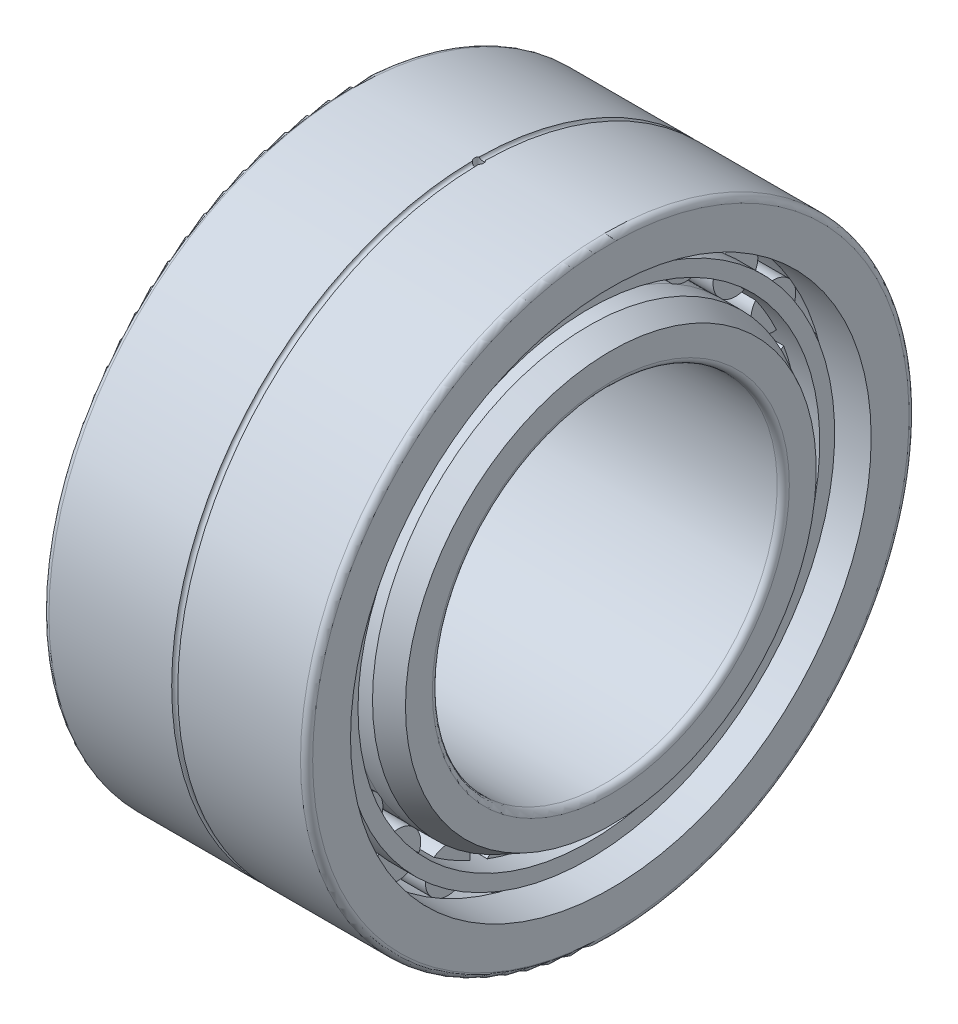
from build123d import *

# Parameters (mm, degrees)
SKETCH2_W               = 8.666666666
SKETCH2_H               = 1.103333333
CIRCULAR_PATTERN1_COUNT = 24
SKETCH4_W               = 10.833333334
SKETCH4_H               = 0.735555556
SKETCH5_R               = 0.15
SKETCH6_R               = 0.225
CUT_EXTRUDE1_DEPTH      = 2.166666667


with BuildPart() as part:
    # Sketch1 → Revolve1 (revolve)
    with BuildSketch(Plane.XY, mode=Mode.PRIVATE) as revolve1_sk:
        with BuildLine():
            Line((4.333333333, 12.853333333), (4.333333333, 12.833333333))
            Line((4.333333333, 12.833333333), (6.5, 12.833333333))
            Line((6.5, 12.833333333), (6.5, 14.7))
            ThreePointArc((6.5, 14.7), (6.412132034, 14.912132034), (6.2, 15))
            Line((6.2, 15), (-6.2, 15))
            ThreePointArc((-6.2, 15), (-6.412132034, 14.912132034), (-6.5, 14.7))
            Line((-6.5, 14.7), (-6.5, 12.833333333))
            Line((-6.5, 12.833333333), (-4.333333333, 12.833333333))
            Line((-4.333333333, 12.833333333), (-4.333333333, 12.853333333))
            Line((-4.333333333, 12.853333333), (4.333333333, 12.853333333))
        make_face()
    revolve(revolve1_sk.sketch.rotate(Axis((-6.5, 0, 0), (1, 0, 0)), 90), axis=Axis((-6.5, 0, 0), (1, 0, 0)))

    # Sketch7 → Cut-Revolve2 (revolve, cut)
    with BuildSketch(Plane.XY, mode=Mode.PRIVATE) as cut_revolve2_sk:
        with BuildLine():
            Line((-4.261111111, 13.266666667), (4.261111111, 13.266666667))
            ThreePointArc((4.261111111, 13.266666667), (4.384402156, 13.31773549), (4.333333333, 13.194444444))
            Line((4.333333333, 13.194444444), (4.333333333, 12.633333333))
            Line((4.333333333, 12.633333333), (-4.333333333, 12.633333333))
            Line((-4.333333333, 12.633333333), (-4.333333333, 13.194444444))
            ThreePointArc((-4.333333333, 13.194444444), (-4.384402156, 13.31773549), (-4.261111111, 13.266666667))
        make_face()
    revolve(cut_revolve2_sk.sketch.rotate(Axis((0, 0, 0), (1, 0, 0)), 90), axis=Axis((0, 0, 0), (1, 0, 0)), mode=Mode.SUBTRACT)

    # Sketch5 → Cut-Revolve1 (revolve, cut)
    with BuildSketch(Plane(origin=(0, 0, 0), x_dir=(1, 0, 0), z_dir=(0, 1, 0)), mode=Mode.PRIVATE) as cut_revolve1_sk:
        with Locations((0, 15)):
            Circle(SKETCH5_R)
    revolve(cut_revolve1_sk.sketch.rotate(Axis((-3.429038921, 0, 0), (1, 0, 0)), 180), axis=Axis((-3.429038921, 0, 0), (1, 0, 0)), mode=Mode.SUBTRACT)


with BuildPart() as body_2:
    # Sketch2 → Revolve2 (revolve)
    with BuildSketch(Plane.XY, mode=Mode.PRIVATE) as revolve2_sk:
        with Locations((0, 12.301666667)):
            Rectangle(SKETCH2_W, SKETCH2_H)
    revolve(revolve2_sk.sketch.rotate(Axis((-21.371880709, 11.75, 0), (1, 0, 0)), 90), axis=Axis((-21.371880709, 11.75, 0), (1, 0, 0)))


with BuildPart() as body_3:
    # Sketch1<4> → Revolve3 (revolve)
    with BuildSketch(Plane.XY, mode=Mode.PRIVATE) as revolve3_sk:
        with BuildLine():
            ThreePointArc((-6.5, 8.8), (-6.412132034, 8.587867966), (-6.2, 8.5))
            Line((-6.2, 8.5), (6.2, 8.5))
            ThreePointArc((6.2, 8.5), (6.412132034, 8.587867966), (6.5, 8.8))
            Line((6.5, 8.8), (6.5, 10.125))
            Line((6.5, 10.125), (5.416666667, 10.666666667))
            Line((5.416666667, 10.666666667), (4.333333333, 10.666666667))
            Line((4.333333333, 10.666666667), (4.333333333, 10.646666667))
            Line((4.333333333, 10.646666667), (-4.333333333, 10.646666667))
            Line((-4.333333333, 10.646666667), (-4.333333333, 10.666666667))
            Line((-4.333333333, 10.666666667), (-5.416666667, 10.666666667))
            Line((-5.416666667, 10.666666667), (-6.5, 10.125))
            Line((-6.5, 10.125), (-6.5, 8.8))
        make_face()
    revolve(revolve3_sk.sketch.rotate(Axis((-6.5, 0, 0), (1, 0, 0)), 90), axis=Axis((-6.5, 0, 0), (1, 0, 0)))


with BuildPart() as circular_pattern1_1:
    # Circular-Pattern1: pattern copy
    add(body_2.part.rotate(Axis((0, 0, 0), (1, 0, 0)), 1 * 360 / CIRCULAR_PATTERN1_COUNT))


with BuildPart() as circular_pattern1_2:
    # Circular-Pattern1: pattern copy
    add(body_2.part.rotate(Axis((0, 0, 0), (1, 0, 0)), 2 * 360 / CIRCULAR_PATTERN1_COUNT))


with BuildPart() as circular_pattern1_3:
    # Circular-Pattern1: pattern copy
    add(body_2.part.rotate(Axis((0, 0, 0), (1, 0, 0)), 3 * 360 / CIRCULAR_PATTERN1_COUNT))


with BuildPart() as circular_pattern1_4:
    # Circular-Pattern1: pattern copy
    add(body_2.part.rotate(Axis((0, 0, 0), (1, 0, 0)), 4 * 360 / CIRCULAR_PATTERN1_COUNT))


with BuildPart() as circular_pattern1_5:
    # Circular-Pattern1: pattern copy
    add(body_2.part.rotate(Axis((0, 0, 0), (1, 0, 0)), 5 * 360 / CIRCULAR_PATTERN1_COUNT))


with BuildPart() as circular_pattern1_6:
    # Circular-Pattern1: pattern copy
    add(body_2.part.rotate(Axis((0, 0, 0), (1, 0, 0)), 6 * 360 / CIRCULAR_PATTERN1_COUNT))


with BuildPart() as circular_pattern1_7:
    # Circular-Pattern1: pattern copy
    add(body_2.part.rotate(Axis((0, 0, 0), (1, 0, 0)), 7 * 360 / CIRCULAR_PATTERN1_COUNT))


with BuildPart() as circular_pattern1_8:
    # Circular-Pattern1: pattern copy
    add(body_2.part.rotate(Axis((0, 0, 0), (1, 0, 0)), 8 * 360 / CIRCULAR_PATTERN1_COUNT))


with BuildPart() as circular_pattern1_9:
    # Circular-Pattern1: pattern copy
    add(body_2.part.rotate(Axis((0, 0, 0), (1, 0, 0)), 9 * 360 / CIRCULAR_PATTERN1_COUNT))


with BuildPart() as circular_pattern1_10:
    # Circular-Pattern1: pattern copy
    add(body_2.part.rotate(Axis((0, 0, 0), (1, 0, 0)), 10 * 360 / CIRCULAR_PATTERN1_COUNT))


with BuildPart() as circular_pattern1_11:
    # Circular-Pattern1: pattern copy
    add(body_2.part.rotate(Axis((0, 0, 0), (1, 0, 0)), 11 * 360 / CIRCULAR_PATTERN1_COUNT))


with BuildPart() as circular_pattern1_12:
    # Circular-Pattern1: pattern copy
    add(body_2.part.rotate(Axis((0, 0, 0), (1, 0, 0)), 12 * 360 / CIRCULAR_PATTERN1_COUNT))


with BuildPart() as circular_pattern1_13:
    # Circular-Pattern1: pattern copy
    add(body_2.part.rotate(Axis((0, 0, 0), (1, 0, 0)), 13 * 360 / CIRCULAR_PATTERN1_COUNT))


with BuildPart() as circular_pattern1_14:
    # Circular-Pattern1: pattern copy
    add(body_2.part.rotate(Axis((0, 0, 0), (1, 0, 0)), 14 * 360 / CIRCULAR_PATTERN1_COUNT))


with BuildPart() as circular_pattern1_15:
    # Circular-Pattern1: pattern copy
    add(body_2.part.rotate(Axis((0, 0, 0), (1, 0, 0)), 15 * 360 / CIRCULAR_PATTERN1_COUNT))


with BuildPart() as circular_pattern1_16:
    # Circular-Pattern1: pattern copy
    add(body_2.part.rotate(Axis((0, 0, 0), (1, 0, 0)), 16 * 360 / CIRCULAR_PATTERN1_COUNT))


with BuildPart() as circular_pattern1_17:
    # Circular-Pattern1: pattern copy
    add(body_2.part.rotate(Axis((0, 0, 0), (1, 0, 0)), 17 * 360 / CIRCULAR_PATTERN1_COUNT))


with BuildPart() as circular_pattern1_18:
    # Circular-Pattern1: pattern copy
    add(body_2.part.rotate(Axis((0, 0, 0), (1, 0, 0)), 18 * 360 / CIRCULAR_PATTERN1_COUNT))


with BuildPart() as circular_pattern1_19:
    # Circular-Pattern1: pattern copy
    add(body_2.part.rotate(Axis((0, 0, 0), (1, 0, 0)), 19 * 360 / CIRCULAR_PATTERN1_COUNT))


with BuildPart() as circular_pattern1_20:
    # Circular-Pattern1: pattern copy
    add(body_2.part.rotate(Axis((0, 0, 0), (1, 0, 0)), 20 * 360 / CIRCULAR_PATTERN1_COUNT))


with BuildPart() as circular_pattern1_21:
    # Circular-Pattern1: pattern copy
    add(body_2.part.rotate(Axis((0, 0, 0), (1, 0, 0)), 21 * 360 / CIRCULAR_PATTERN1_COUNT))


with BuildPart() as circular_pattern1_22:
    # Circular-Pattern1: pattern copy
    add(body_2.part.rotate(Axis((0, 0, 0), (1, 0, 0)), 22 * 360 / CIRCULAR_PATTERN1_COUNT))


with BuildPart() as circular_pattern1_23:
    # Circular-Pattern1: pattern copy
    add(body_2.part.rotate(Axis((0, 0, 0), (1, 0, 0)), 23 * 360 / CIRCULAR_PATTERN1_COUNT))


with BuildPart() as body_2_1:
    add(body_2.part)

    add(circular_pattern1_1.part)  # Revolve4 merges Circular-Pattern1_1

    add(circular_pattern1_2.part)  # Revolve4 merges Circular-Pattern1_2

    add(circular_pattern1_3.part)  # Revolve4 merges Circular-Pattern1_3

    add(circular_pattern1_4.part)  # Revolve4 merges Circular-Pattern1_4

    add(circular_pattern1_5.part)  # Revolve4 merges Circular-Pattern1_5

    add(circular_pattern1_6.part)  # Revolve4 merges Circular-Pattern1_6

    add(circular_pattern1_7.part)  # Revolve4 merges Circular-Pattern1_7

    add(circular_pattern1_8.part)  # Revolve4 merges Circular-Pattern1_8

    add(circular_pattern1_9.part)  # Revolve4 merges Circular-Pattern1_9

    add(circular_pattern1_10.part)  # Revolve4 merges Circular-Pattern1_10

    add(circular_pattern1_11.part)  # Revolve4 merges Circular-Pattern1_11

    add(circular_pattern1_12.part)  # Revolve4 merges Circular-Pattern1_12

    add(circular_pattern1_13.part)  # Revolve4 merges Circular-Pattern1_13

    add(circular_pattern1_14.part)  # Revolve4 merges Circular-Pattern1_14

    add(circular_pattern1_15.part)  # Revolve4 merges Circular-Pattern1_15

    add(circular_pattern1_16.part)  # Revolve4 merges Circular-Pattern1_16

    add(circular_pattern1_17.part)  # Revolve4 merges Circular-Pattern1_17

    add(circular_pattern1_18.part)  # Revolve4 merges Circular-Pattern1_18

    add(circular_pattern1_19.part)  # Revolve4 merges Circular-Pattern1_19

    add(circular_pattern1_20.part)  # Revolve4 merges Circular-Pattern1_20

    add(circular_pattern1_21.part)  # Revolve4 merges Circular-Pattern1_21

    add(circular_pattern1_22.part)  # Revolve4 merges Circular-Pattern1_22

    add(circular_pattern1_23.part)  # Revolve4 merges Circular-Pattern1_23
    # Sketch4 → Revolve4 (revolve)
    with BuildSketch(Plane.XY, mode=Mode.PRIVATE) as revolve4_sk:
        with Locations((0, 11.75)):
            Rectangle(SKETCH4_W, SKETCH4_H)
    revolve(revolve4_sk.sketch.rotate(Axis((-6.5, 0, 0), (1, 0, 0)), 90), axis=Axis((-6.5, 0, 0), (1, 0, 0)))


with BuildPart() as cut_extrude1_tool:
    # Sketch6 → Cut-Extrude1 (new body)
    with BuildSketch(Plane(origin=(0, 15, 0), x_dir=(1, 0, 0), z_dir=(0, 1, 0))):
        with Locations(Location((0, 0, 0), (0, 0, 270))):
            Circle(SKETCH6_R)
    cut_extrude1 = extrude(amount=-CUT_EXTRUDE1_DEPTH)


with BuildPart() as part_1:
    add(part.part)

    # Cut-Extrude1: cut by cut_extrude1_tool
    add(cut_extrude1_tool.part, mode=Mode.SUBTRACT)


with BuildPart() as body_2_2:
    add(body_2_1.part)

    # Cut-Extrude1: cut by cut_extrude1_tool
    add(cut_extrude1_tool.part, mode=Mode.SUBTRACT)


with BuildPart() as mirror1_tool:
    # Mirror1: Cut-Extrude1 across plane
    add(cut_extrude1.mirror(Plane.ZX))


with BuildPart() as part_2:
    add(part_1.part)

    # Mirror1: cut by mirror1_tool
    add(mirror1_tool.part, mode=Mode.SUBTRACT)


with BuildPart() as body_2_3:
    add(body_2_2.part)

    # Mirror1: cut by mirror1_tool
    add(mirror1_tool.part, mode=Mode.SUBTRACT)


solid = Compound([body_3.part, part_2.part, body_2_3.part])
